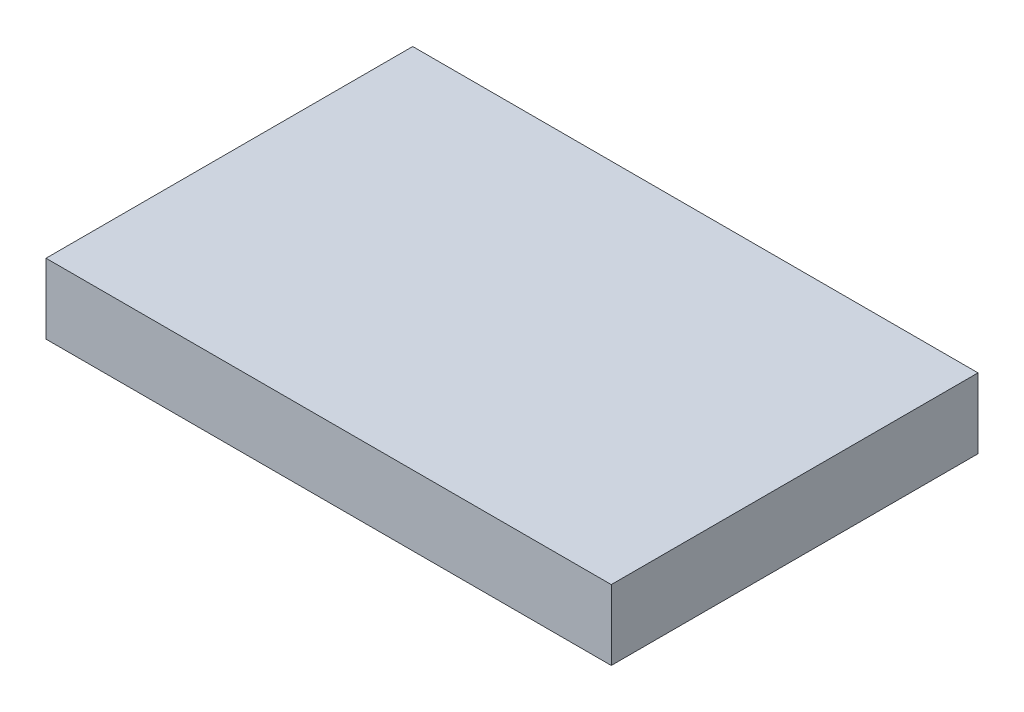
from build123d import *

# Parameters (mm, degrees)
SKETCH1_W           = 614.68
SKETCH1_H           = 398.78
BOSS_EXTRUDE2_DEPTH = 76.2


with BuildPart() as part:
    # Sketch1 → Boss-Extrude2 (new body)
    with BuildSketch(Plane(origin=(0, 0, 0), x_dir=(1, 0, 0), z_dir=(0, 1, 0))):
        with Locations((324.04, 143.867716774)):
            Rectangle(SKETCH1_W, SKETCH1_H)
    extrude(amount=BOSS_EXTRUDE2_DEPTH)


solid = part.part
